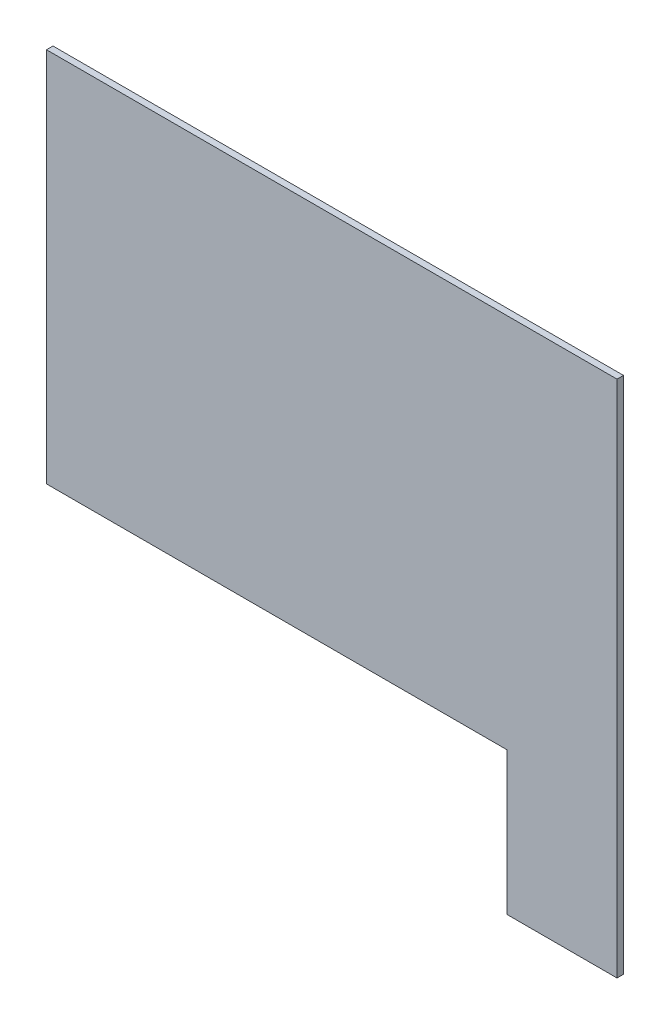
from build123d import *

# Parameters (mm, degrees)
SALIENTE_EXTRUIR1_DEPTH = 5


with BuildPart() as part:
    # Croquis1 → Saliente-Extruir1 (new body)
    with BuildSketch(Plane(origin=(0, 0, 0), x_dir=(-1, 0, 0), z_dir=(0, 0, 1))):
        Polygon((-143.586706802, 402.295789036), (-228.586706802, 402.295789036), (-228.586706802, 2.295789036), (211.413293198, 2.295789036), (211.413293198, 292.295789036), (-143.586706802, 292.295789036), align=None)
    extrude(amount=SALIENTE_EXTRUIR1_DEPTH)


solid = part.part
